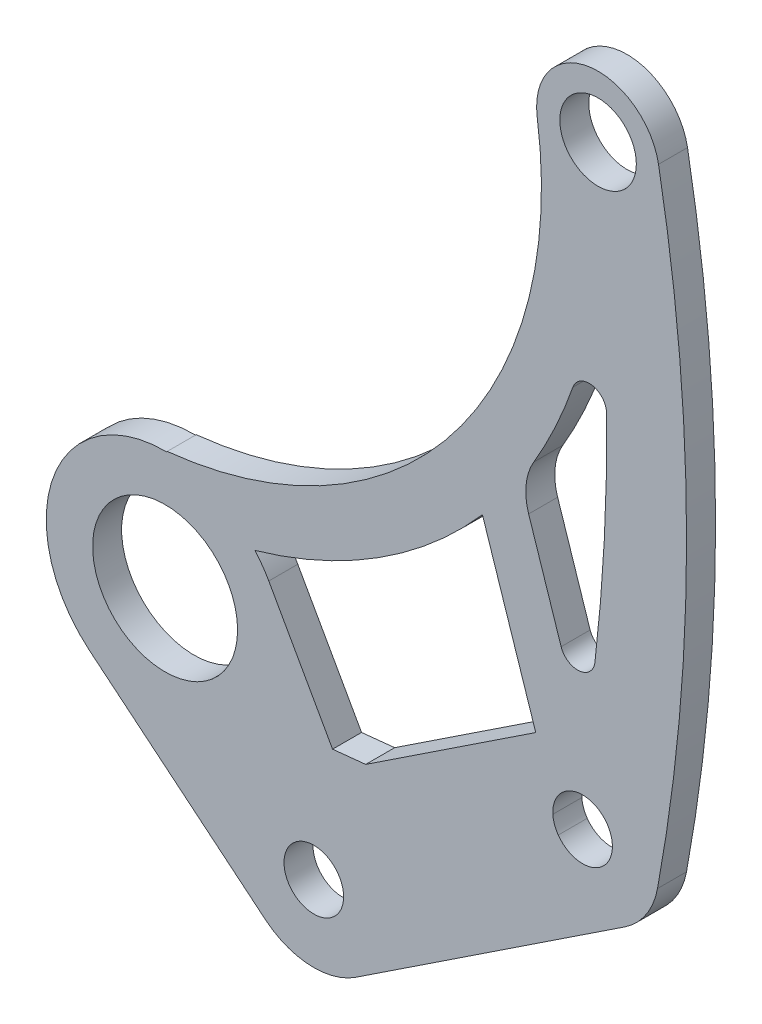
from build123d import *

# Parameters (mm, degrees)
SKETCH2_R           = 7.9375
SKETCH2_R_2         = 3.2639
SKETCH2_R_3         = 4.191
BOSS_EXTRUDE1_DEPTH = 3.175
FILLET3_R           = 1.905
FILLET4_R           = 6.35


with BuildPart() as part:
    # Sketch2 → Boss-Extrude1 (new body)
    with BuildSketch(Plane.XY):
        with BuildLine():
            ThreePointArc((53.924522294, -1.518710351), (57.106411985, 32.846575285), (54.035830718, 67.22198524))
            ThreePointArc((54.035830718, 67.22198524), (46.333024889, 72.662028043), (40.750647472, 65.061742146))
            ThreePointArc((40.750647472, 65.061742146), (31.550758366, 30.452598432), (0.230104832, 13.090356345))
            Line((0.230104832, 13.090356345), (0.171615761, 13.016368706))
            ThreePointArc((0.171615761, 13.016368706), (-12.221668504, 4.481754704), (-8.283857999, -10.041563768))
            Line((-8.283857999, -10.041563768), (10.974906006, -25.929215326))
            ThreePointArc((10.974906006, -25.929215326), (15.847415014, -27.825253688), (20.891605497, -26.449590983))
            Line((20.891605497, -26.449590983), (50.326948559, -6.956773116))
            ThreePointArc((50.326948559, -6.956773116), (52.678920751, -4.603703856), (53.924522294, -1.518710351))
        make_face()
        Circle(SKETCH2_R, mode=Mode.SUBTRACT)
        with Locations((16.284656938, -19.492817867)):
            Circle(SKETCH2_R_2, mode=Mode.SUBTRACT)
        with Locations((45.72, 0)):
            Circle(SKETCH2_R_2, mode=Mode.SUBTRACT)
        with BuildLine():
            Line((40.587817362, 6.608950017), (21.967466437, -5.721910488))
            Line((21.967466437, -5.721910488), (18.339656124, -6.094706177))
            Line((18.339656124, -6.094706177), (11.355144297, 6.365218318))
            ThreePointArc((11.355144297, 6.365218318), (10.656204093, 7.476671758), (9.848859751, 8.512066016))
            ThreePointArc((9.848859751, 8.512066016), (23.445327069, 14.632175726), (34.749899024, 24.354640398))
            Line((34.749899024, 24.354640398), (40.587817362, 6.608950017))
        make_face(mode=Mode.SUBTRACT)
        with BuildLine():
            ThreePointArc((47.523781163, 56.501393309), (48.257752726, 32.370804269), (45.933946154, 8.34115665))
            Line((45.933946154, 8.34115665), (38.882442516, 29.775817606))
            ThreePointArc((38.882442516, 29.775817606), (45.039190515, 42.544935267), (47.523781163, 56.501393309))
        make_face(mode=Mode.SUBTRACT)
        with Locations((47.413333333, 66.018287029)):
            Circle(SKETCH2_R_3, mode=Mode.SUBTRACT)
    extrude(amount=BOSS_EXTRUDE1_DEPTH)

    # Fillet3
    fillet3_edges = [part.edges().sort_by_distance(p)[0] for p in [
        (47.523781163, 56.501393309, 1.5875),
        (45.933946154, 8.34115665, 1.5875),
    ]]
    fillet(fillet3_edges, radius=FILLET3_R)

    # Fillet4
    fillet4_edges = [part.edges().sort_by_distance(p)[0] for p in [
        (38.882442516, 29.775817606, 1.5875),
    ]]
    fillet(fillet4_edges, radius=FILLET4_R)


solid = part.part
